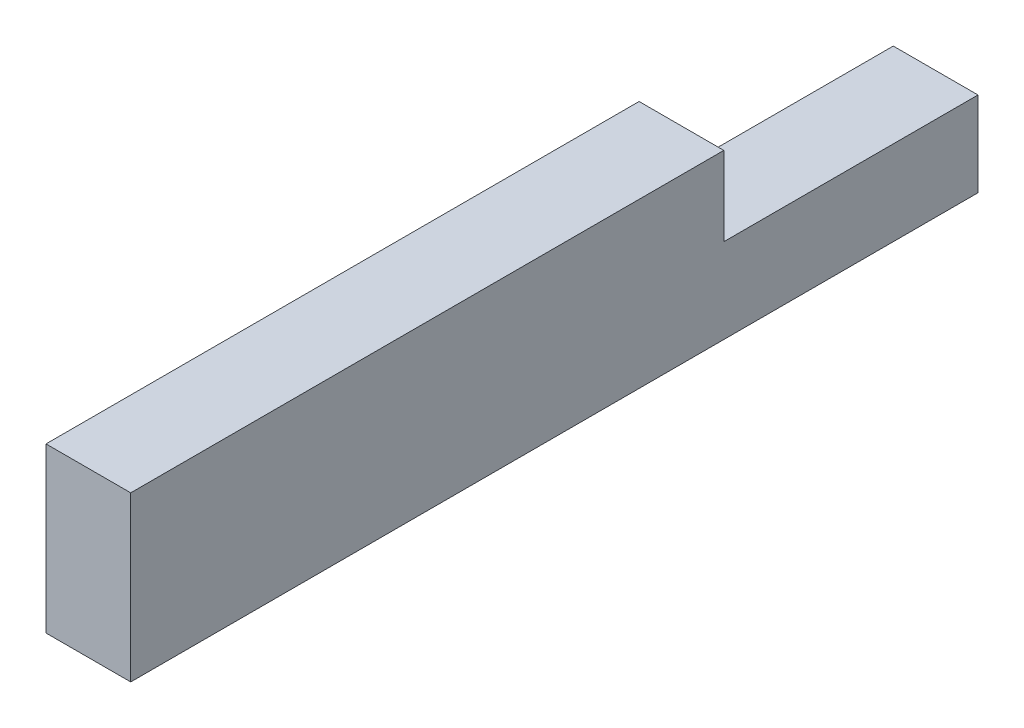
from build123d import *

# Parameters (mm, degrees)
SKETCH_1_W      = 3
SKETCH_1_H      = 3
EXTRUDE_1_DEPTH = 30
SKETCH_2_W      = 3
SKETCH_2_H      = 21
EXTRUDE_2_DEPTH = 2.8


with BuildPart() as part:
    # ｽｹｯﾁ1 → ﾎﾞｽ - 押し出し1 (new body)
    with BuildSketch(Plane.XY):
        Rectangle(SKETCH_1_W, SKETCH_1_H)
    extrude(amount=EXTRUDE_1_DEPTH)

    # ｽｹｯﾁ2 → ﾎﾞｽ - 押し出し2 (add)
    with BuildSketch(Plane(origin=(0, 1.5, 0), x_dir=(1, 0, 0), z_dir=(0, 1, 0))):
        with Locations((0, -19.5)):
            Rectangle(SKETCH_2_W, SKETCH_2_H)
    extrude(amount=EXTRUDE_2_DEPTH)


solid = part.part
